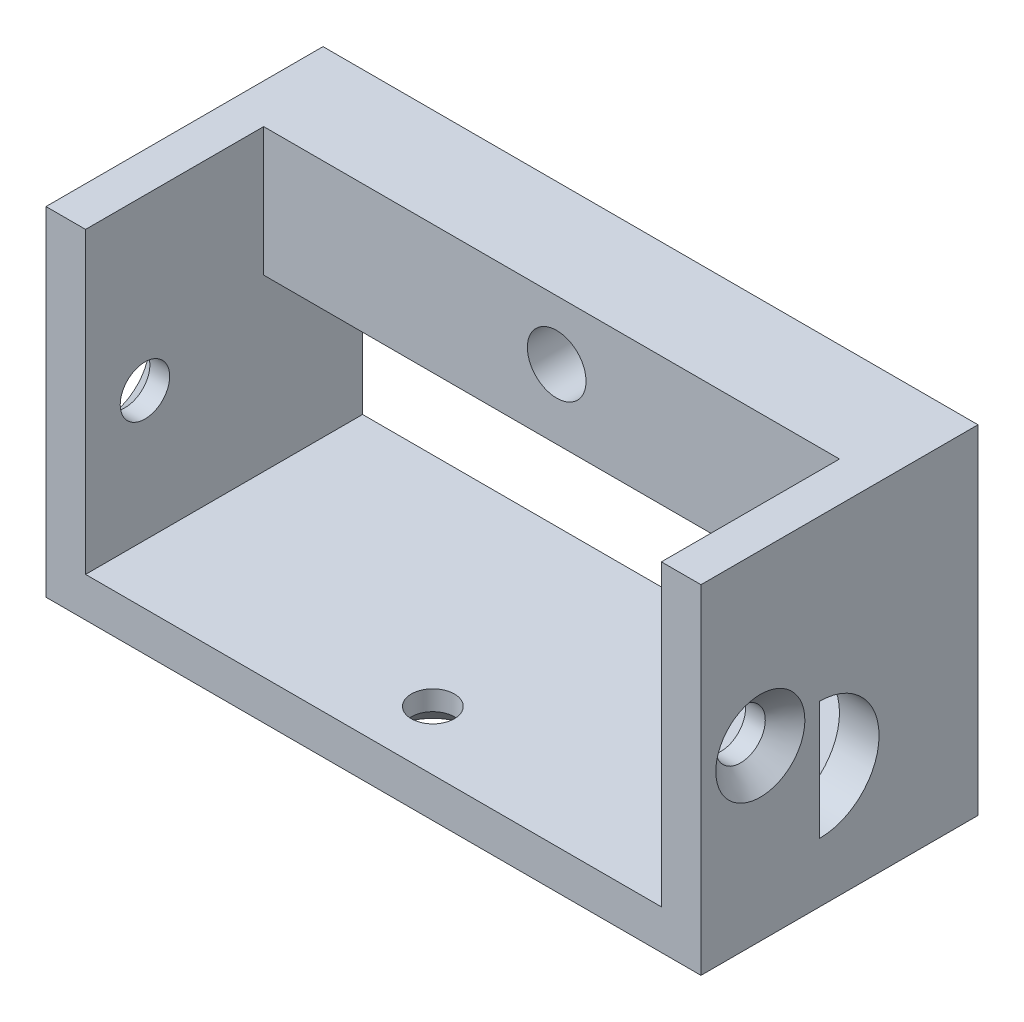
from build123d import *

# Parameters (mm, degrees)
SKETCH_1_W             = 29.1
SKETCH_1_H             = 6.5
EXTRUDE_1_DEPTH        = 5
EXTRUDE_2_DEPTH        = 8
SKETCH_3_R             = 3
CUT_EXTRUDE_1118_DEPTH = 3
EXTRUDE_1407_DEPTH     = 6
SKETCH_5_R             = 1.25
CUT_EXTRUDE_2_DEPTH    = 38.469587668
CHAMFER_1_SIZE         = 1
SKETCH_6_R             = 1.087134162
CUT_EXTRUDE_3_DEPTH    = 5
CHAMFER_2_SIZE         = 1
SKETCH_7_R             = 1.482090692
CUT_EXTRUDE_4_DEPTH    = 5
CHAMFER_3_SIZE         = 1


with BuildPart() as part:
    # Эскиз1 → Бобышка-Вытянуть1 (new body)
    with BuildSketch(Plane.XY):
        with Locations((-14.55, 3.25)):
            Rectangle(SKETCH_1_W, SKETCH_1_H)
    extrude(amount=EXTRUDE_1_DEPTH)

    # Эскиз2 → Бобышка-Вытянуть2 (add)
    with BuildSketch(Plane(origin=(0, 0, 0), x_dir=(-1, 0, 0), z_dir=(0, 0, -1))):
        Polygon((0, -8.6), (-2, -8.6), (-2, -10.6), (31.1, -10.6), (31.1, -8.6), (29.1, -8.6), align=None)
        Polygon((0, 0), (0, 6.5), (-2, 6.5), (-2, -8.6), (0, -8.6), align=None)
        Polygon((29.1, 0), (29.1, -8.6), (31.1, -8.6), (31.1, 6.5), (29.1, 6.5), align=None)
    extrude(amount=-EXTRUDE_2_DEPTH)

    # Эскиз3 → Cut-Extrude 1118 (cut)
    with BuildSketch(Plane(origin=(2, 0, 0), x_dir=(0, 0, -1), z_dir=(1, 0, 0))):
        with Locations((-8, -4.6)):
            Circle(SKETCH_3_R)
    extrude(amount=-CUT_EXTRUDE_1118_DEPTH, mode=Mode.SUBTRACT)

    # Эскиз4 → Extrude 1407 (add)
    with BuildSketch(Plane.XY.offset(8)):
        Polygon((2, 6.5), (2, -10.6), (-31.1, -10.6), (-31.1, 6.5), (-29.1, 6.5), (-29.1, -8.6), (0, -8.6), (0, 6.5), align=None)
    extrude(amount=EXTRUDE_1407_DEPTH)

    # Эскиз5 → Вырез-Вытянуть2 (cut, through all)
    with BuildSketch(Plane(origin=(2, 0, 0), x_dir=(0, 0, -1), z_dir=(1, 0, 0))):
        with Locations(Location((-11, -2.05, 0), (0, 0, 90))):
            Circle(SKETCH_5_R)
    extrude(amount=-CUT_EXTRUDE_2_DEPTH, mode=Mode.SUBTRACT)

    # Фаска1
    chamfer_1_edges = [part.edges().sort_by_distance(p)[0] for p in [
        (-31.1, -3.3, 11),
        (2, -3.3, 11),
    ]]
    chamfer(chamfer_1_edges, length=CHAMFER_1_SIZE)

    # Эскиз6 → Вырез-Вытянуть3 (cut)
    with BuildSketch(Plane(origin=(0, -10.6, 0), x_dir=(-1, 0, 0), z_dir=(0, -1, 0))):
        with Locations(Location((14.55, -11, 0), (0, 0, 90))):
            Circle(SKETCH_6_R)
    extrude(amount=-CUT_EXTRUDE_3_DEPTH, mode=Mode.SUBTRACT)

    # Фаска2
    chamfer_2_edges = [part.edges().sort_by_distance(p)[0] for p in [
        (-14.55, -10.6, 12.087134162),
    ]]
    chamfer(chamfer_2_edges, length=CHAMFER_2_SIZE)

    # Эскиз7 → Вырез-Вытянуть4 (cut)
    with BuildSketch(Plane(origin=(0, 0, 0), x_dir=(-1, 0, 0), z_dir=(0, 0, -1))):
        with Locations((14.290801776, 3.5)):
            Circle(SKETCH_7_R)
    extrude(amount=-CUT_EXTRUDE_4_DEPTH, mode=Mode.SUBTRACT)

    # Фаска3
    chamfer_3_edges = [part.edges().sort_by_distance(p)[0] for p in [
        (-12.808711084, 3.5, 0),
    ]]
    chamfer(chamfer_3_edges, length=CHAMFER_3_SIZE)


solid = part.part
